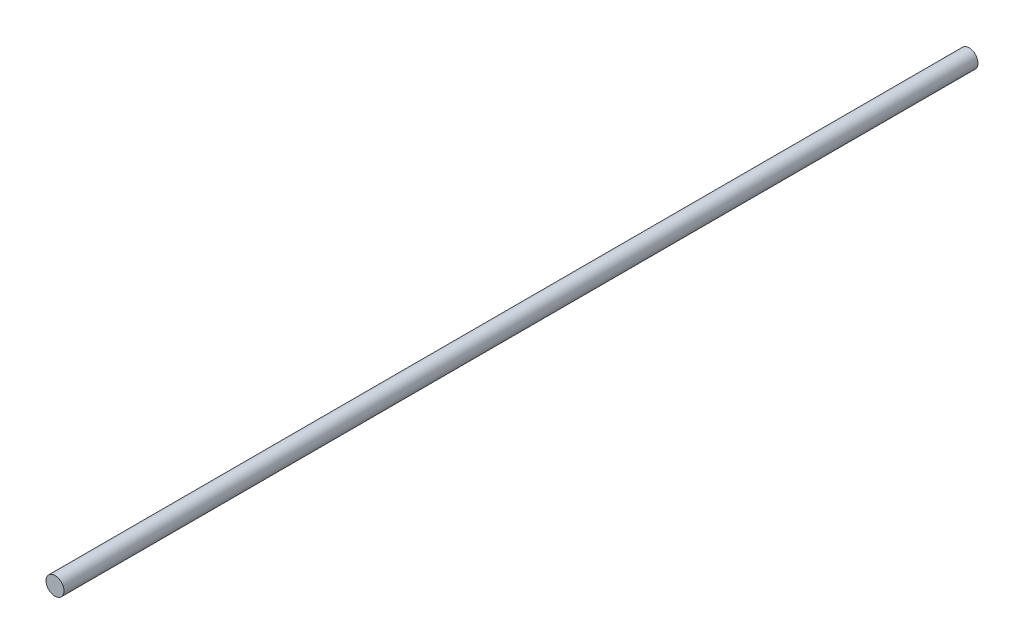
from build123d import *

# Parameters (mm, degrees)
SKETCH1_R           = 6
BOSS_EXTRUDE1_DEPTH = 610


with BuildPart() as part:
    # Sketch1 → Boss-Extrude1 (new body)
    with BuildSketch(Plane.XY.offset(5)):
        with Locations((1000, 642)):
            Circle(SKETCH1_R)
    extrude(amount=-BOSS_EXTRUDE1_DEPTH)


solid = part.part
